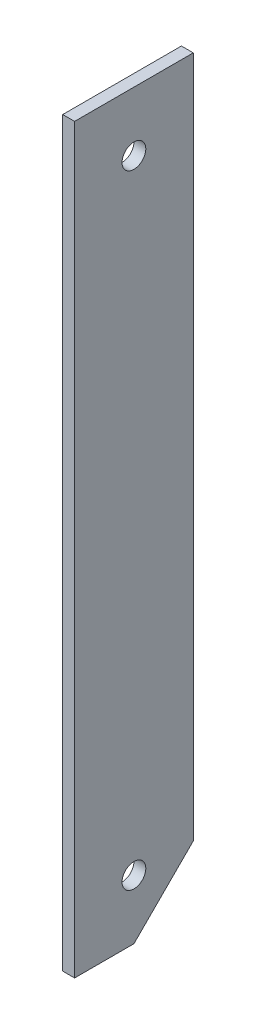
from build123d import *

# Parameters (mm, degrees)
SKETCH1_W           = 40
SKETCH1_H           = 250
SKETCH1_R           = 4
BOSS_EXTRUDE1_DEPTH = 4
CHAMFER3_SIZE       = 20


with BuildPart() as part:
    # Sketch1 → Boss-Extrude1 (new body)
    with BuildSketch(Plane(origin=(0, 0, 0), x_dir=(0, 0, -1), z_dir=(1, 0, 0))):
        Rectangle(SKETCH1_W, SKETCH1_H)
        with Locations((0, 105)):
            Circle(SKETCH1_R, mode=Mode.SUBTRACT)
        with Locations((0, -105)):
            Circle(SKETCH1_R, mode=Mode.SUBTRACT)
    extrude(amount=BOSS_EXTRUDE1_DEPTH)

    # Chamfer3
    chamfer3_edges = [part.edges().sort_by_distance(p)[0] for p in [
        (2, -125, -20),
    ]]
    chamfer(chamfer3_edges, length=CHAMFER3_SIZE)


solid = part.part
